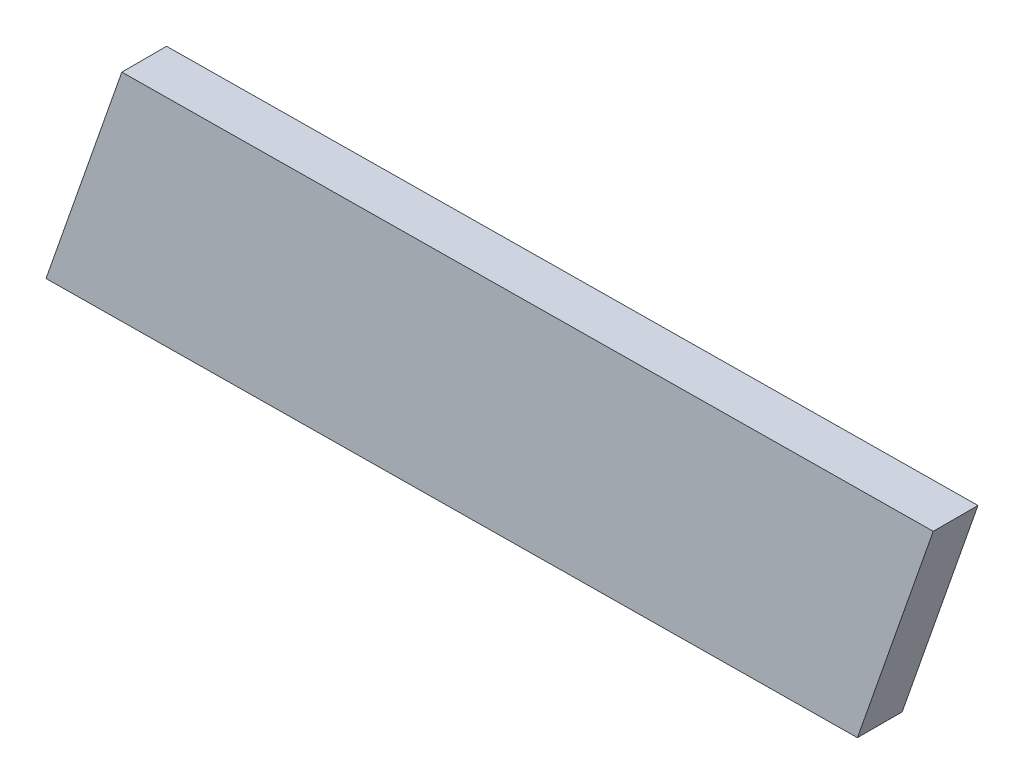
from build123d import *

# Parameters (mm, degrees)
BOSS_EXTRUDE2_DEPTH = 10
SKETCH3_W           = 29.532068245
SKETCH3_H           = 5.332178988
SKETCH3_W_2         = 29.737152051
SKETCH3_W_3         = 30.967654895
SKETCH3_W_4         = 26.86597875
BOSS_EXTRUDE3_DEPTH = 0.5
SCALE1_SCALE        = 5


with BuildPart() as part:
    # Sketch2 → Boss-Extrude2 (new body)
    with BuildSketch(Plane.XY):
        Polygon((0, 0), (16.944463815, 48.421938639), (198.277369744, 50.219093306), (181.332905929, 1.797154667), align=None)
    extrude(amount=BOSS_EXTRUDE2_DEPTH)

    # Sketch3 → Boss-Extrude3 (add)
    with BuildSketch(Plane(origin=(0, 0, 0), x_dir=(-1, 0, 0), z_dir=(0, 0, -1))):
        with Locations((-160.253659434, 25.929881882)):
            Rectangle(SKETCH3_W, SKETCH3_H)
        with Locations((-113.802177091, 26.134965689)):
            Rectangle(SKETCH3_W_2, SKETCH3_H)
        with Locations((-67.453236652, 25.929881882)):
            Rectangle(SKETCH3_W_3, SKETCH3_H)
        with Locations((-29.51273231, 26.134965689)):
            Rectangle(SKETCH3_W_4, SKETCH3_H)
    extrude(amount=BOSS_EXTRUDE3_DEPTH)


with BuildPart() as part_1:
    # Scale1: scaled about (99.120137523, 25.112815696, 4.981334283)
    add(part.part.scale(SCALE1_SCALE).moved(Location((-396.480550092, -100.451262784, -19.925337132))))


solid = part_1.part
